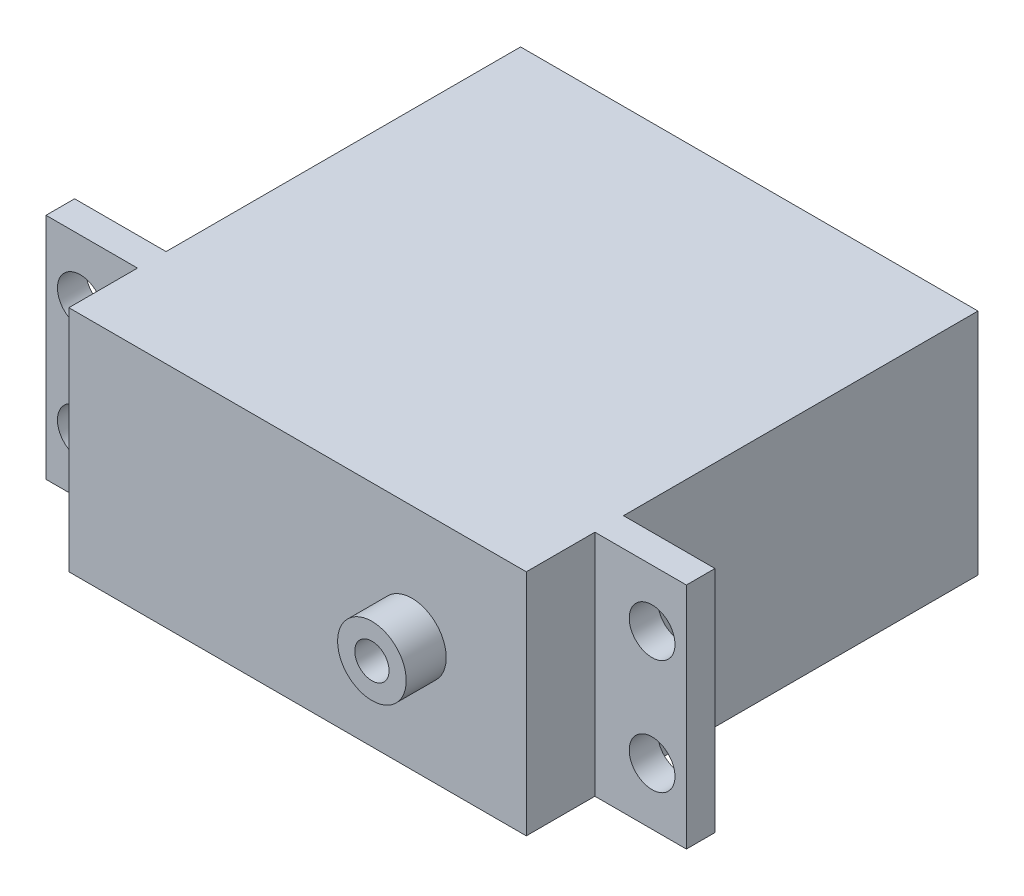
from build123d import *

# Parameters (mm, degrees)
SKETCH_1_W      = 40
SKETCH_1_H      = 20
EXTRUDE_1_DEPTH = 39.5
SKETCH_2_R      = 3
SKETCH_2_R_2    = 1.5
EXTRUDE_2_DEPTH = 3.5
SKETCH_4_W      = 56
SKETCH_4_H      = 20
SKETCH_4_R      = 2
EXTRUDE_3_DEPTH = 2.5


with BuildPart() as part:
    # 草图1 → 凸台-拉伸1 (new body)
    with BuildSketch(Plane.XY):
        Rectangle(SKETCH_1_W, SKETCH_1_H)
    extrude(amount=EXTRUDE_1_DEPTH)

    # 草图2 → 凸台-拉伸2 (add)
    with BuildSketch(Plane.XY.offset(39.5)):
        with Locations(Location((10, 0, 0), (0, 0, 180))):
            Circle(SKETCH_2_R)
        with Locations((10, 0)):
            Circle(SKETCH_2_R_2, mode=Mode.SUBTRACT)
    extrude(amount=EXTRUDE_2_DEPTH)

    # 草图4 → 凸台-拉伸3 (add)
    with BuildSketch(Plane.XY.offset(33.5)):
        Rectangle(SKETCH_4_W, SKETCH_4_H)
        with Locations((25, 5)):
            Circle(SKETCH_4_R, mode=Mode.SUBTRACT)
        with Locations((25, -5)):
            Circle(SKETCH_4_R, mode=Mode.SUBTRACT)
        with Locations((-25, 5)):
            Circle(SKETCH_4_R, mode=Mode.SUBTRACT)
        with Locations((-25, -5)):
            Circle(SKETCH_4_R, mode=Mode.SUBTRACT)
    extrude(amount=-EXTRUDE_3_DEPTH)


solid = part.part
